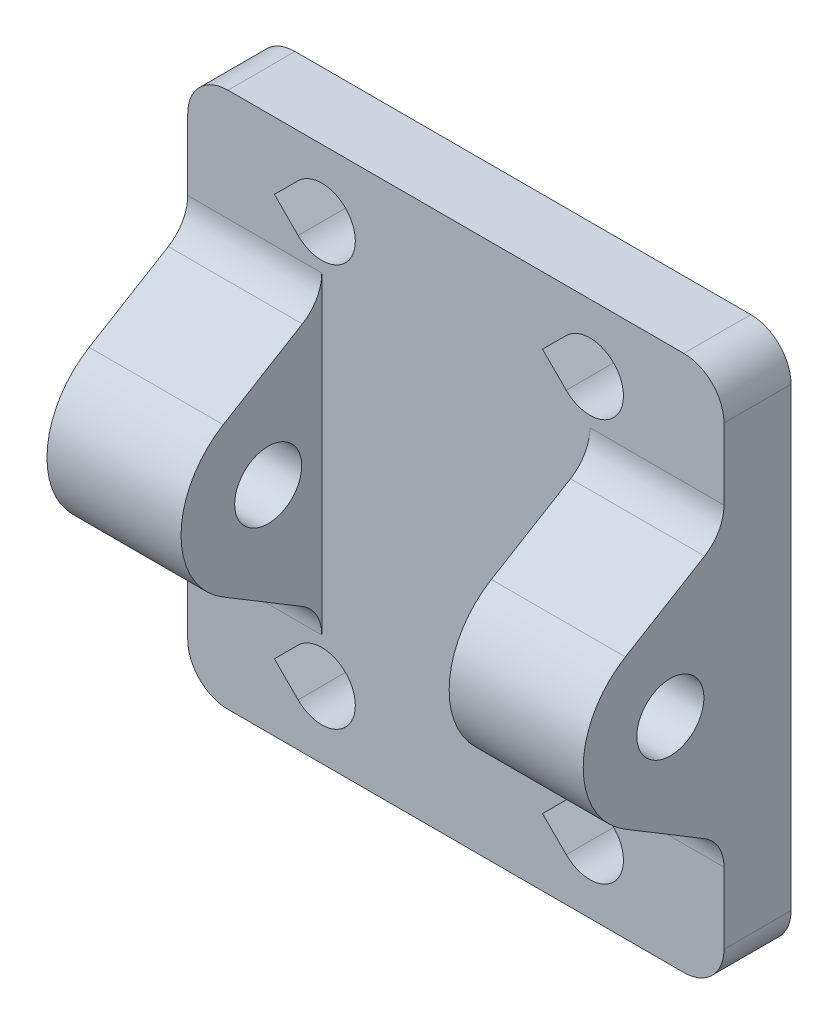
from build123d import *

# Parameters (mm, degrees)
SKETCH1_W              = 40
SKETCH1_H              = 40
BOSS_EXTRUDE1_DEPTH    = 5
CUT_EXTRUDE1_DEPTH     = 57.789083458
SKETCH3_R              = 2.5
BOSS_EXTRUDE2_DEPTH    = 10
FILLET1_R              = 3
LPATTERN1_COUNT        = 2
LPATTERN1_PITCH        = 30
FILLET1_OF_LPATTERN1_R = 3
FILLET2_R              = 3


with BuildPart() as part:
    # Sketch1 → Boss-Extrude1 (new body)
    with BuildSketch(Plane.XY):
        with Locations((20, 20)):
            Rectangle(SKETCH1_W, SKETCH1_H)
    extrude(amount=BOSS_EXTRUDE1_DEPTH)

    # Sketch2 → Cut-Extrude1 (cut, through all)
    with BuildSketch(Plane.XY.offset(5)):
        with BuildLine():
            Line((8.232233047, 36.767766953), (6.464466094, 35))
            Line((6.464466094, 35), (8.232233047, 33.232233047))
            ThreePointArc((8.232233047, 33.232233047), (12.5, 35), (8.232233047, 36.767766953))
        make_face()
        with BuildLine():
            Line((26.464466094, 35), (28.232233047, 33.232233047))
            ThreePointArc((28.232233047, 33.232233047), (32.5, 35), (28.232233047, 36.767766953))
            Line((28.232233047, 36.767766953), (26.464466094, 35))
        make_face()
        with BuildLine():
            Line((26.464466094, 5), (28.232233047, 3.232233047))
            ThreePointArc((28.232233047, 3.232233047), (32.5, 5), (28.232233047, 6.767766953))
            Line((28.232233047, 6.767766953), (26.464466094, 5))
        make_face()
        with BuildLine():
            Line((6.464466094, 5), (8.232233047, 3.232233047))
            ThreePointArc((8.232233047, 3.232233047), (12.5, 5), (8.232233047, 6.767766953))
            Line((8.232233047, 6.767766953), (6.464466094, 5))
        make_face()
    extrude(amount=-CUT_EXTRUDE1_DEPTH, mode=Mode.SUBTRACT)

    # Sketch3 → Boss-Extrude2 (add)
    with BuildSketch(Plane.ZY):
        with BuildLine():
            Line((12.355222683, 25.567089073), (5, 30))
            Line((5, 30), (5, 10))
            Line((5, 10), (12.355222683, 14.432910927))
            ThreePointArc((12.355222683, 14.432910927), (15.5, 20), (12.355222683, 25.567089073))
        make_face()
        with Locations((9, 20)):
            Circle(SKETCH3_R, mode=Mode.SUBTRACT)
    boss_extrude2 = extrude(amount=-BOSS_EXTRUDE2_DEPTH)

    # Fillet1
    fillet1_edges = [part.edges().sort_by_distance(p)[0] for p in [
        (5, 10, 5),
        (5, 30, 5),
    ]]
    fillet(fillet1_edges, radius=FILLET1_R)

    # LPattern1: Boss-Extrude2 ×2
    with Locations(*[(i * LPATTERN1_PITCH, 0, 0) for i in range(1, LPATTERN1_COUNT)]):
        add(boss_extrude2)

    # Fillet1 of LPattern1
    fillet1_of_lpattern1_edges = [part.edges().sort_by_distance(p)[0] for p in [
        (35, 10, 5),
        (35, 30, 5),
    ]]
    fillet(fillet1_of_lpattern1_edges, radius=FILLET1_OF_LPATTERN1_R)

    # Fillet2
    fillet2_edges = [part.edges().sort_by_distance(p)[0] for p in [
        (0, 40, 2.5),
        (40, 40, 2.5),
        (40, 0, 2.5),
        (0, 0, 2.5),
    ]]
    fillet(fillet2_edges, radius=FILLET2_R)


solid = part.part
